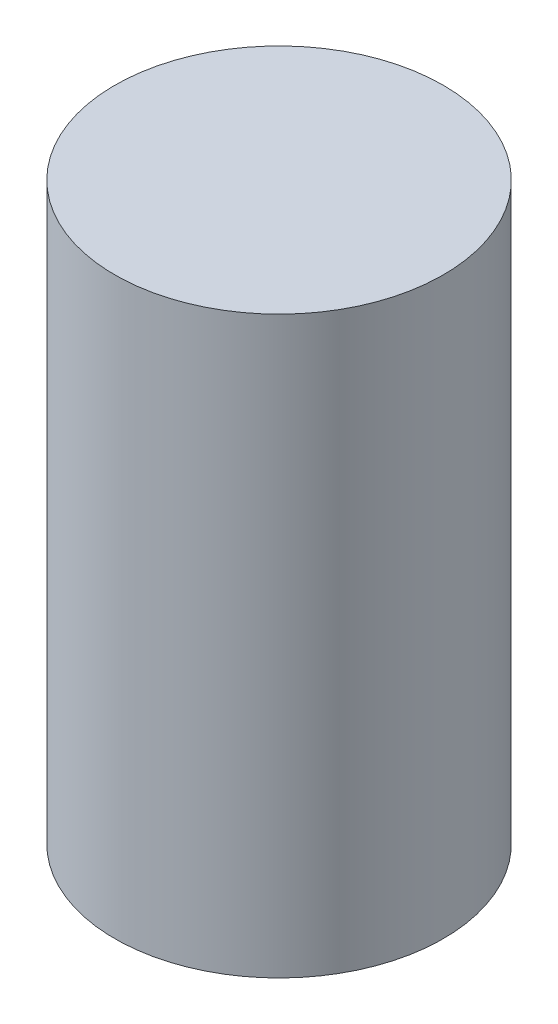
from build123d import *

# Parameters (mm, degrees)
SKETCH1_W = 10
SKETCH1_H = 35


with BuildPart() as part:
    # Sketch1 → Revolve1 (revolve)
    with BuildSketch(Plane.XY, mode=Mode.PRIVATE) as revolve1_sk:
        with Locations((5, 17.5)):
            Rectangle(SKETCH1_W, SKETCH1_H)
    revolve(revolve1_sk.sketch.rotate(Axis((0, 0, 0), (0, 1, 0)), 90), axis=Axis((0, 0, 0), (0, 1, 0)))


solid = part.part
